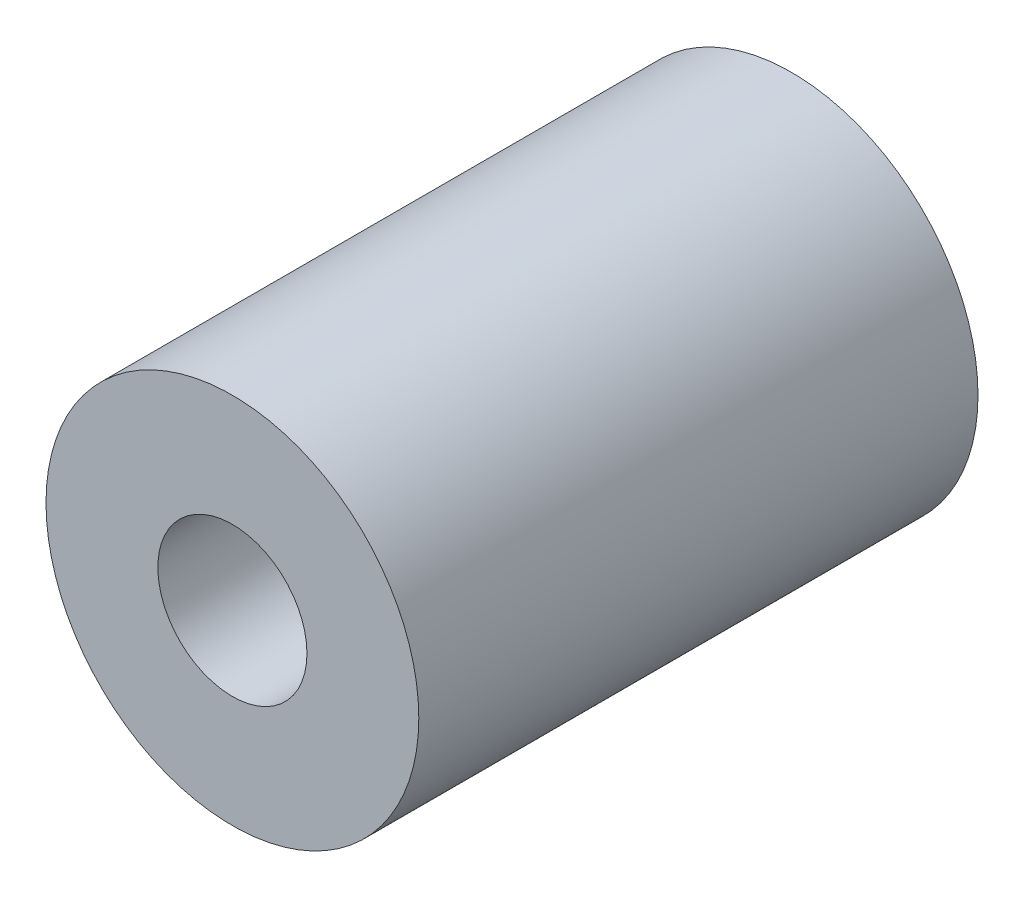
from build123d import *

# Parameters (mm, degrees)
SKETCH_1_R      = 4
SKETCH_1_R_2    = 1.6
EXTRUDE_1_DEPTH = 12


with BuildPart() as part:
    # ｽｹｯﾁ1 → ﾎﾞｽ - 押し出し1 (new body)
    with BuildSketch(Plane.XY):
        Circle(SKETCH_1_R)
        Circle(SKETCH_1_R_2, mode=Mode.SUBTRACT)
    extrude(amount=EXTRUDE_1_DEPTH)


solid = part.part
